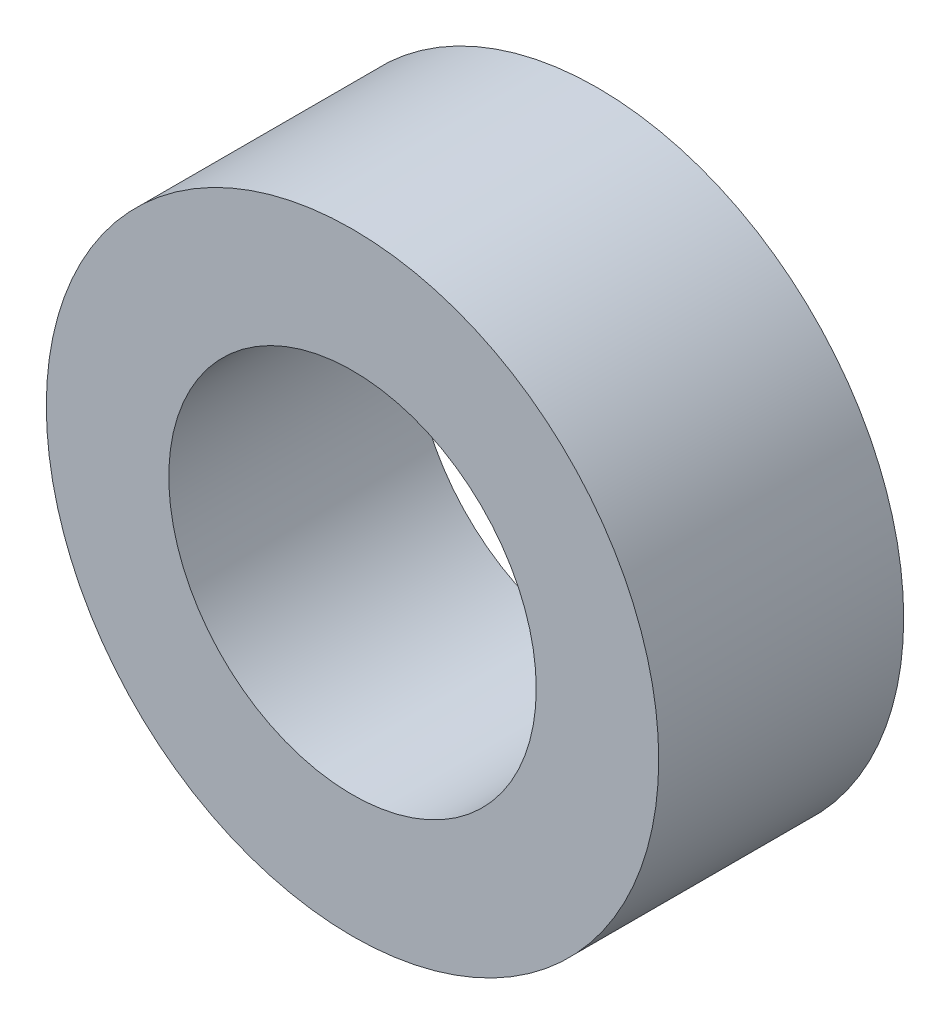
from build123d import *

# Parameters (mm, degrees)
SKETCH_1_R      = 12.5
SKETCH_1_R_2    = 7.5
EXTRUDE_1_DEPTH = 10


with BuildPart() as part:
    # 스케치1 → 보스-돌출1 (new body)
    with BuildSketch(Plane.XY):
        Circle(SKETCH_1_R)
        Circle(SKETCH_1_R_2, mode=Mode.SUBTRACT)
    extrude(amount=EXTRUDE_1_DEPTH)


solid = part.part
